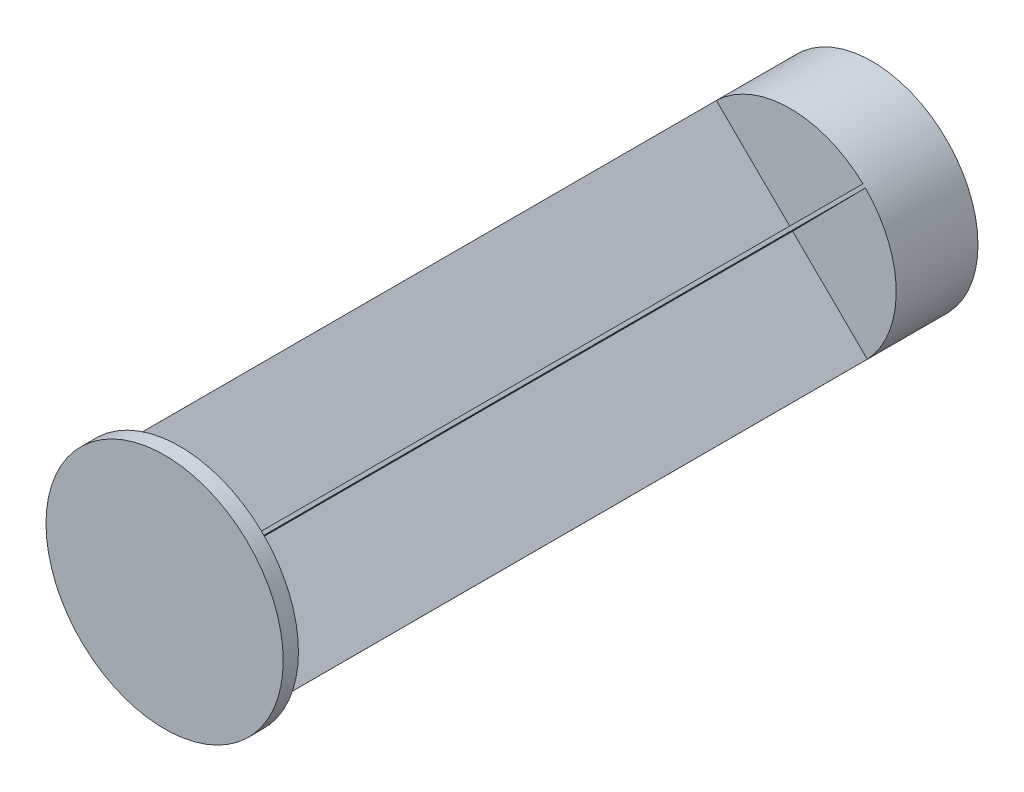
from build123d import *

# Parameters (mm, degrees)
SKETCH1_R           = 23.31
BOSS_EXTRUDE1_DEPTH = 15
SKETCH2_R           = 23.31
BOSS_EXTRUDE2_DEPTH = 3
BOSS_EXTRUDE5_DEPTH = 134.3
SKETCH4_OUTSIDE_W   = 81.812
SKETCH4_OUTSIDE_H   = 81.812
SKETCH4_OUTSIDE_R   = 23.31
CUT_EXTRUDE2_DEPTH  = 204
SKETCH5_R           = 26.095
BOSS_EXTRUDE6_DEPTH = 3.35


with BuildPart() as part:
    # Sketch1 → Boss-Extrude1 (new body)
    with BuildSketch(Plane.XY):
        Circle(SKETCH1_R)
    extrude(amount=BOSS_EXTRUDE1_DEPTH)

    # Sketch2 → Boss-Extrude2 (add)
    with BuildSketch(Plane.XY.offset(15)):
        Circle(SKETCH2_R)
    extrude(amount=BOSS_EXTRUDE2_DEPTH)

    # Sketch3 → Boss-Extrude5 (add)
    with BuildSketch(Plane.XY.offset(18)):
        with BuildLine():
            Line((-19.00086471, 19.418454901), (-19.738244764, 18.741128654))
            Line((-19.738244764, 18.741128654), (-0.707086702, -0.005328765))
            Line((-0.707086702, -0.005328765), (-16.710421631, -16.2517048))
            ThreePointArc((-16.710421631, -16.2517048), (-16.44680571, -16.518434609), (-16.178932822, -16.780888914))
            Line((-16.178932822, -16.780888914), (-0.172775102, -0.531647218))
            Line((-0.172775102, -0.531647218), (20.92357267, -21.312399704))
            Line((20.92357267, -21.312399704), (21.625330607, -20.599984237))
            Line((21.625330607, -20.599984237), (0.528982835, 0.180768249))
            Line((0.528982835, 0.180768249), (16.535140556, 16.430009945))
            ThreePointArc((16.535140556, 16.430009945), (16.26867879, 16.693896801), (15.998006164, 16.953462737))
            Line((15.998006164, 16.953462737), (-0.005328765, 0.707086702))
            Line((-0.005328765, 0.707086702), (-19.00086471, 19.418454901))
        make_face()
    extrude(amount=BOSS_EXTRUDE5_DEPTH)

    # Sketch4 outside → Cut-Extrude2 (cut)
    with BuildSketch(Plane.XY.offset(18)):
        Rectangle(SKETCH4_OUTSIDE_W, SKETCH4_OUTSIDE_H)
        with Locations(Location((0, 0, 0), (0, 0, 136.660875724))):
            Circle(SKETCH4_OUTSIDE_R, mode=Mode.SUBTRACT)
    extrude(amount=CUT_EXTRUDE2_DEPTH, mode=Mode.SUBTRACT)

    # Sketch5 → Boss-Extrude6 (add)
    with BuildSketch(Plane.XY.offset(152.3)):
        Circle(SKETCH5_R)
    extrude(amount=BOSS_EXTRUDE6_DEPTH)


solid = part.part
